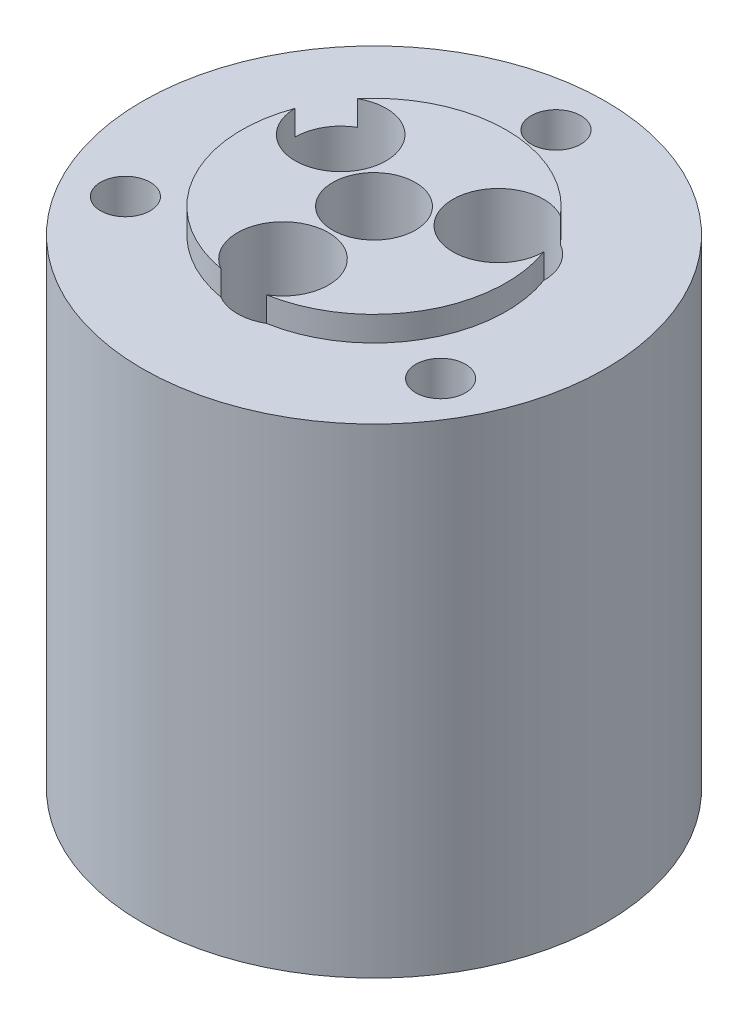
from build123d import *

# Parameters (mm, degrees)
ESQUISSE2_R                         = 1.5
ENL_V_MAT_EXTRU_1_DEPTH             = 10
ESQUISSE3_R                         = 1.5
ENL_V_MAT_EXTRU_2_DEPTH             = 37.362755671
ENL_V_MAT_EXTRU_2_DIRECTION_2_REACH = 38.363
ESQUISSE4_R                         = 2.75
ENL_V_MAT_EXTRU_7_DEPTH             = 20
ENL_V_START                         = -8
ESQUISSE5_R                         = 8
ENL_V_MAT_EXTRU_8_DEPTH             = 8


with BuildPart() as part:
    # Esquisse1 → Révolution1 (revolve)
    with BuildSketch(Plane.XY):
        Polygon((8, 0), (8, 1.5), (14, 1.5), (14, 30.5), (8, 30.5), (8, 32), (2.5, 32), (2.5, 0), align=None)
    revolve(axis=Axis((0, 0, 0), (0, 1, 0)))

    # Esquisse2 → Enlèv. mat.-Extru.1 (cut)
    with BuildSketch(Plane(origin=(0, 30.5, 0), x_dir=(1, 0, 0), z_dir=(0, 1, 0))):
        with Locations(Location((0, 11, 0), (0, 0, 180))):
            Circle(ESQUISSE2_R)
        with Locations(Location((9.526279442, -5.5, 0), (0, 0, 180))):
            Circle(ESQUISSE2_R)
        with Locations(Location((-9.526279442, -5.5, 0), (0, 0, 180))):
            Circle(ESQUISSE2_R)
    extrude(amount=-ENL_V_MAT_EXTRU_1_DEPTH, mode=Mode.SUBTRACT)

    # Esquisse3 → Enlèv. mat.-Extru.2 (cut)
    with BuildSketch(Plane.XZ.offset(-1.5)):
        with Locations(Location((0, 5.5, 0), (0, 0, 180))):
            Circle(ESQUISSE3_R)
        with Locations(Location((4.763139721, -2.75, 0), (0, 0, 180))):
            Circle(ESQUISSE3_R)
        with Locations(Location((-4.763139721, -2.75, 0), (0, 0, 180))):
            Circle(ESQUISSE3_R)
    extrude(amount=-ENL_V_MAT_EXTRU_2_DEPTH, mode=Mode.SUBTRACT)

    # Esquisse3 → Enlèv. mat.-Extru.2 direction 2 (cut, up to next)
    with BuildSketch(Plane.XZ.offset(-1.5), mode=Mode.PRIVATE) as enl_v_mat_extru_2_direction_2_sk1:
        with Locations(Location((0, 5.5, 0), (0, 0, 180))):
            Circle(ESQUISSE3_R)
    enl_v_mat_extru_2_direction_2_tool1 = extrude(enl_v_mat_extru_2_direction_2_sk1.sketch, amount=ENL_V_MAT_EXTRU_2_DIRECTION_2_REACH, mode=Mode.PRIVATE) & part.part
    # Esquisse3 → Enlèv. mat.-Extru.2 direction 2 (cut, up to next)
    with BuildSketch(Plane.XZ.offset(-1.5), mode=Mode.PRIVATE) as enl_v_mat_extru_2_direction_2_sk2:
        with Locations(Location((4.763139721, -2.75, 0), (0, 0, 180))):
            Circle(ESQUISSE3_R)
    enl_v_mat_extru_2_direction_2_tool2 = extrude(enl_v_mat_extru_2_direction_2_sk2.sketch, amount=ENL_V_MAT_EXTRU_2_DIRECTION_2_REACH, mode=Mode.PRIVATE) & part.part
    # Esquisse3 → Enlèv. mat.-Extru.2 direction 2 (cut, up to next)
    with BuildSketch(Plane.XZ.offset(-1.5), mode=Mode.PRIVATE) as enl_v_mat_extru_2_direction_2_sk3:
        with Locations(Location((-4.763139721, -2.75, 0), (0, 0, 180))):
            Circle(ESQUISSE3_R)
    enl_v_mat_extru_2_direction_2_tool3 = extrude(enl_v_mat_extru_2_direction_2_sk3.sketch, amount=ENL_V_MAT_EXTRU_2_DIRECTION_2_REACH, mode=Mode.PRIVATE) & part.part
    add(enl_v_mat_extru_2_direction_2_tool1.solids().sort_by_distance((0, 1.5, 5.5))[0], mode=Mode.SUBTRACT)
    add(enl_v_mat_extru_2_direction_2_tool2.solids().sort_by_distance((4.76314, 1.5, -2.75))[0], mode=Mode.SUBTRACT)
    add(enl_v_mat_extru_2_direction_2_tool3.solids().sort_by_distance((-4.76314, 1.5, -2.75))[0], mode=Mode.SUBTRACT)

    # Esquisse4 → Enlèv. mat.-Extru.7 (cut)
    with BuildSketch(Plane.XZ.offset(-32)):
        with Locations(Location((0, 5.5, 0), (0, 0, 120.036983744))):
            Circle(ESQUISSE4_R)
        with Locations(Location((4.763139721, -2.75, 0), (0, 0, 299.963016256))):
            Circle(ESQUISSE4_R)
        with Locations(Location((-4.763139721, -2.75, 0), (0, 0, 179.963016256))):
            Circle(ESQUISSE4_R)
    extrude(amount=ENL_V_MAT_EXTRU_7_DEPTH, mode=Mode.SUBTRACT)

    # Esquisse5 → Enlèv. mat.-Extru.8 (cut)
    with BuildSketch(Plane.XZ.offset(ENL_V_START)):
        Circle(ESQUISSE5_R)
    extrude(amount=ENL_V_MAT_EXTRU_8_DEPTH, mode=Mode.SUBTRACT)


solid = part.part
